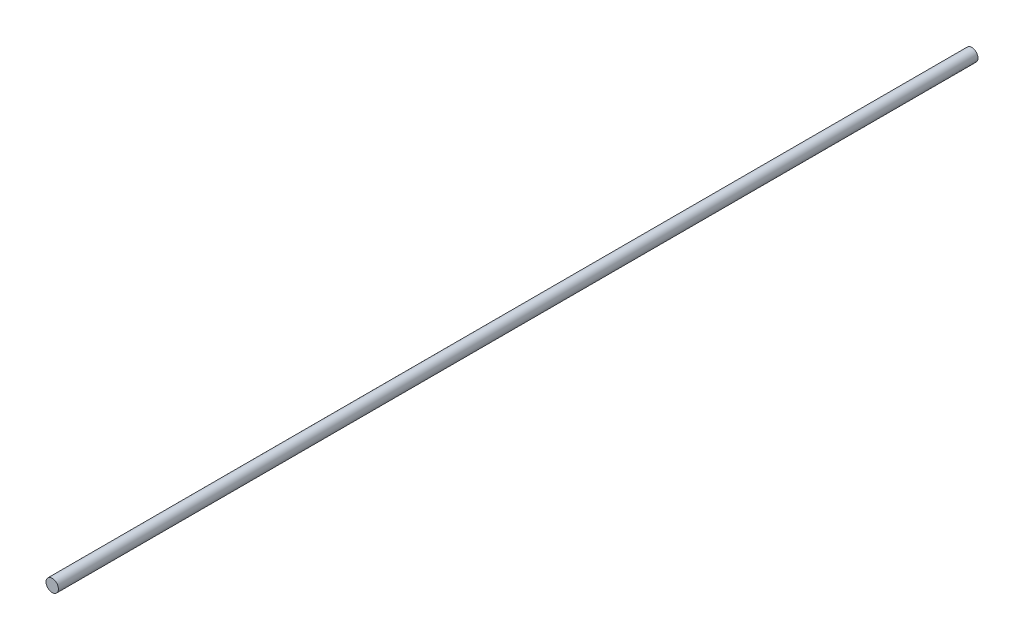
from build123d import *

# Parameters (mm, degrees)
ESQUISSE1_R        = 5
BOSS_EXTRU_1_DEPTH = 740


with BuildPart() as part:
    # Esquisse1 → Boss.-Extru.1 (new body)
    with BuildSketch(Plane.XY):
        Circle(ESQUISSE1_R)
    extrude(amount=BOSS_EXTRU_1_DEPTH)


solid = part.part
